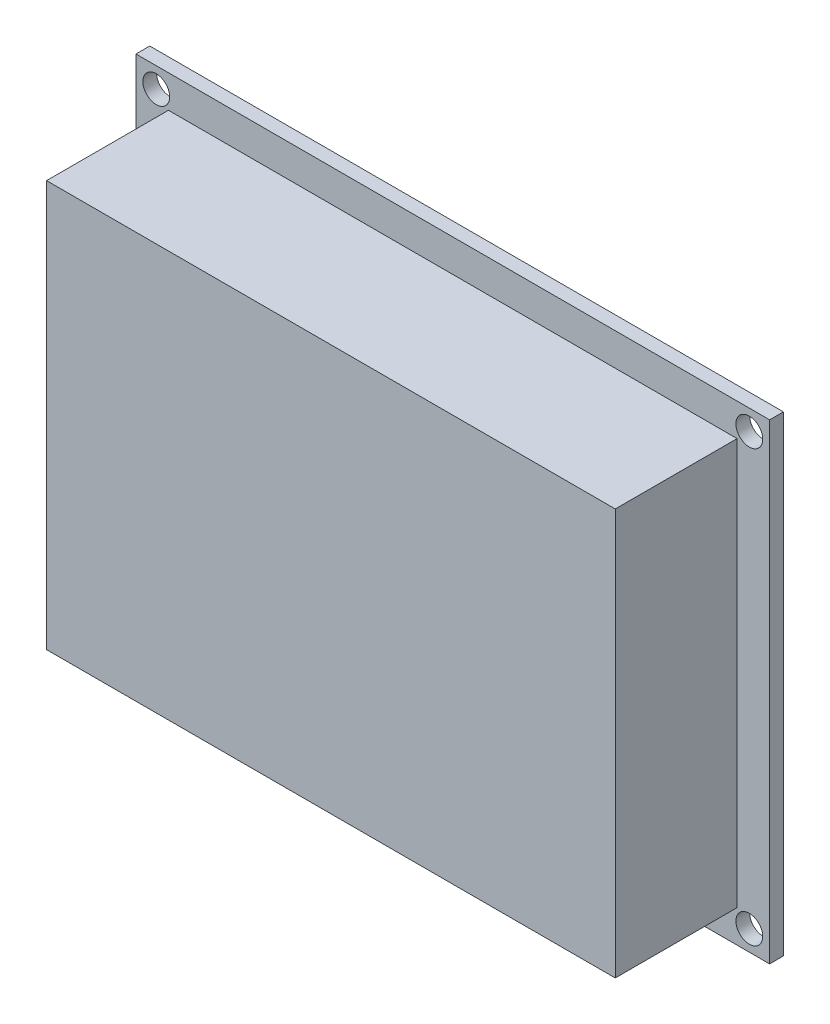
from build123d import *

# Parameters (mm, degrees)
ESBO_O1_W                = 78
ESBO_O1_H                = 58
ESBO_O1_R                = 1.65
RESSALTO_EXTRUS_O1_DEPTH = 1.7
ESBO_O2_W                = 70
ESBO_O2_H                = 50
RESSALTO_EXTRUS_O2_DEPTH = 15


with BuildPart() as part:
    # Esboço1 → Ressalto-extrusão1 (new body)
    with BuildSketch(Plane.XY):
        Rectangle(ESBO_O1_W, ESBO_O1_H)
        with Locations((-36.5, 26.5)):
            Circle(ESBO_O1_R, mode=Mode.SUBTRACT)
        with Locations(Location((-36.5, -26.5, 0), (0, 0, 180))):
            Circle(ESBO_O1_R, mode=Mode.SUBTRACT)
        with Locations(Location((36.5, 26.5, 0), (0, 0, 180))):
            Circle(ESBO_O1_R, mode=Mode.SUBTRACT)
        with Locations((36.5, -26.5)):
            Circle(ESBO_O1_R, mode=Mode.SUBTRACT)
    extrude(amount=RESSALTO_EXTRUS_O1_DEPTH)

    # Esboço2 → Ressalto-extrusão2 (add)
    with BuildSketch(Plane.XY.offset(1.7)):
        Rectangle(ESBO_O2_W, ESBO_O2_H)
    extrude(amount=RESSALTO_EXTRUS_O2_DEPTH)


solid = part.part
